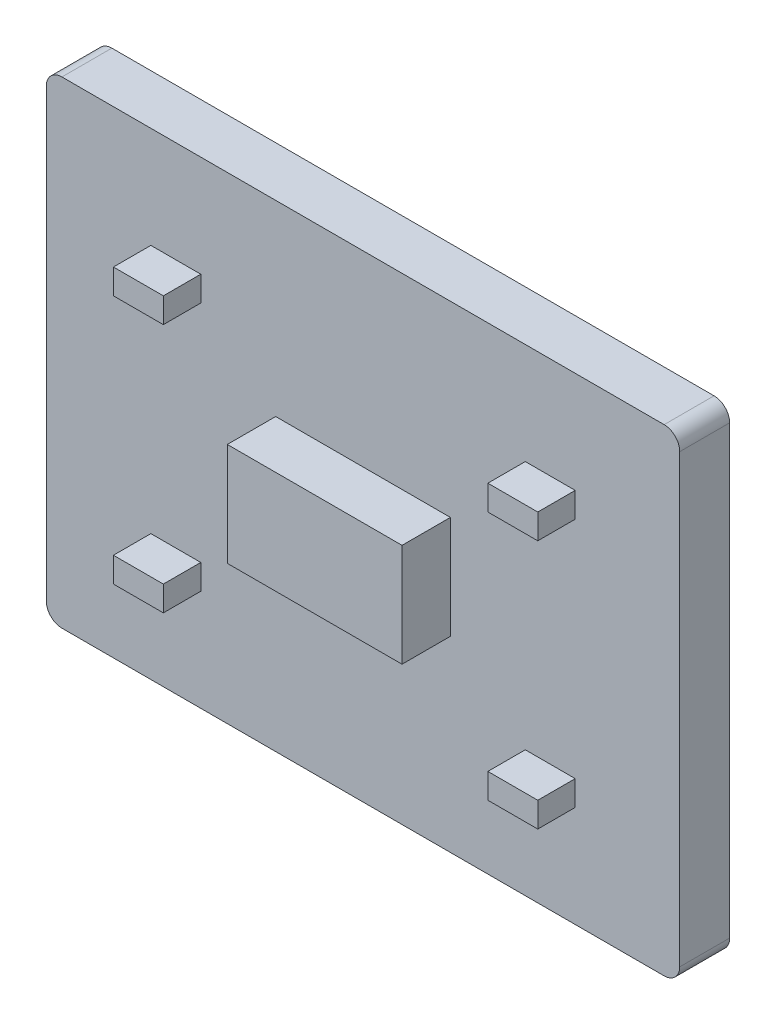
from build123d import *

# Parameters (mm, degrees)
PCB_DEPTH   = 1.6
IC_SK2_W    = 5.6
IC_SK2_H    = 3.3
IC_DEPTH    = 1.55
PARTS_SK3_W = 1.6
PARTS_SK3_H = 0.8
PARTS_DEPTH = 1.2


with BuildPart() as part:
    # PCB_Sk1 → PCB (new body)
    with BuildSketch(Plane.XY.offset(-2)):
        with BuildLine():
            Line((19.35, 3.35), (38.65, 3.35))
            ThreePointArc((38.65, 3.35), (39.003553391, 3.496446609), (39.15, 3.85))
            Line((39.15, 3.85), (39.15, 18.15))
            ThreePointArc((39.15, 18.15), (39.003553391, 18.503553391), (38.65, 18.65))
            Line((38.65, 18.65), (19.35, 18.65))
            ThreePointArc((19.35, 18.65), (18.996446609, 18.503553391), (18.85, 18.15))
            Line((18.85, 18.15), (18.85, 3.85))
            ThreePointArc((18.85, 3.85), (18.996446609, 3.496446609), (19.35, 3.35))
        make_face()
    extrude(amount=-PCB_DEPTH)

    # IC_Sk2 → IC (add)
    with BuildSketch(Plane.XY.offset(-2)):
        with Locations((29, 11)):
            Rectangle(IC_SK2_W, IC_SK2_H)
    extrude(amount=IC_DEPTH)

    # Parts_Sk3 → Parts (add)
    with BuildSketch(Plane.XY.offset(-2)):
        with Locations((23, 7)):
            Rectangle(PARTS_SK3_W, PARTS_SK3_H)
        with Locations((23, 15)):
            Rectangle(PARTS_SK3_W, PARTS_SK3_H)
        with Locations((35, 7)):
            Rectangle(PARTS_SK3_W, PARTS_SK3_H)
        with Locations((35, 15)):
            Rectangle(PARTS_SK3_W, PARTS_SK3_H)
    extrude(amount=PARTS_DEPTH)


solid = part.part
